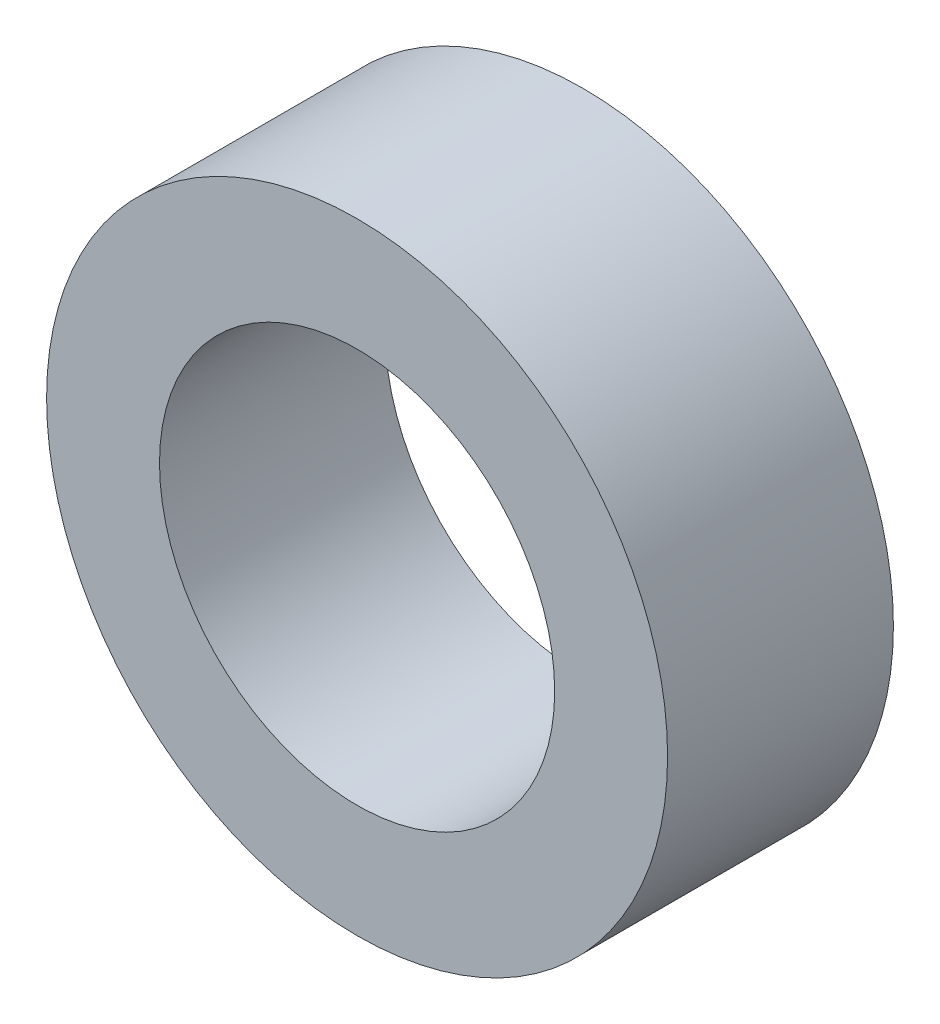
from build123d import *

# Parameters (mm, degrees)
SKETCH_1_R      = 2.75
SKETCH_1_R_2    = 1.75
EXTRUDE_1_DEPTH = 2


with BuildPart() as part:
    # 草图1 → 凸台-拉伸1 (new body)
    with BuildSketch(Plane.XY):
        Circle(SKETCH_1_R)
        Circle(SKETCH_1_R_2, mode=Mode.SUBTRACT)
    extrude(amount=EXTRUDE_1_DEPTH)


solid = part.part
